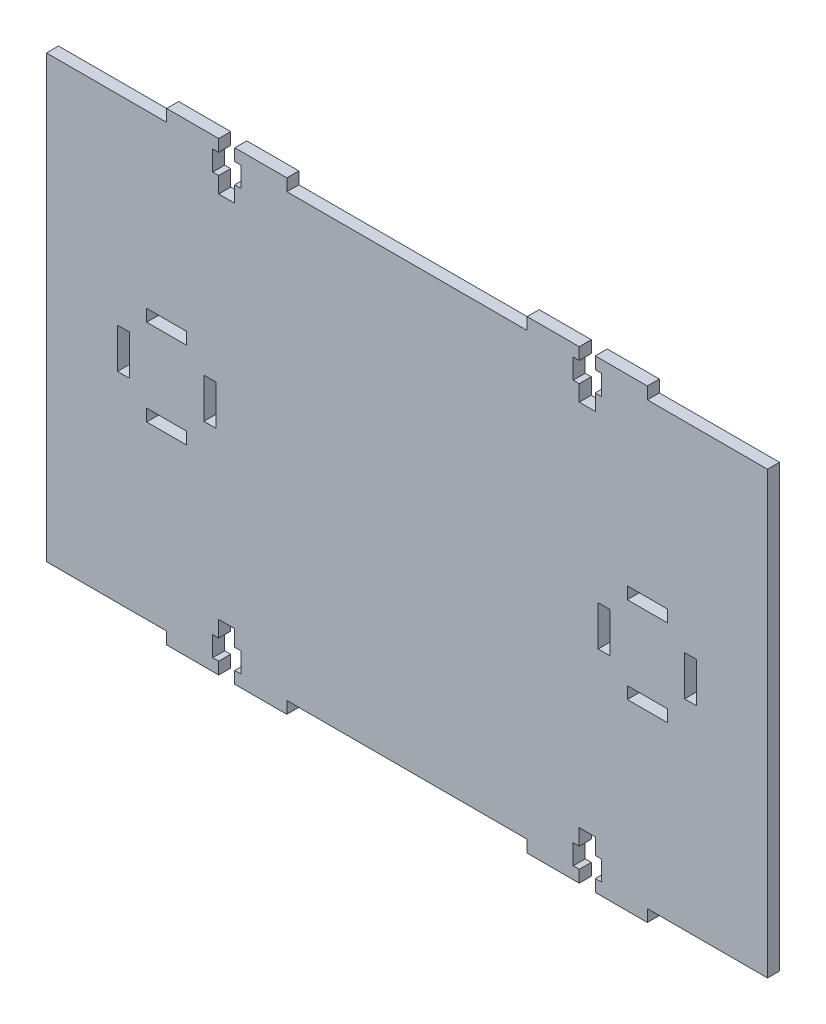
from build123d import *

# Parameters (mm, degrees)
SKETCH1_W                 = 3
SKETCH1_H                 = 3
PLATE_THICKNESS_3MM_DEPTH = 3
SKETCH_1_W                = 10
SKETCH_1_H                = 3
SKETCH_1_W_2              = 3
SKETCH_1_H_2              = 5
CUT_EXTRUDE_1_DEPTH       = 3


with BuildPart() as part:
    # Sketch1 → Plate_thickness_3mm (new body)
    with BuildSketch(Plane.XY):
        Polygon((30, -55), (-30, -55), (-30, -58), (-43, -58), (-43, -55), (-41.5, -55), (-41.5, -50), (-43, -50), (-43, -46), (-47, -46), (-47, -50), (-48.5, -50), (-48.5, -55), (-47, -55), (-47, -58), (-60, -58), (-60, -55), (-90, -55), (-90, 55), (-60, 55), (-60, 58), (-47, 58), (-47, 55), (-48.5, 55), (-48.5, 50), (-47, 50), (-47, 46), (-43, 46), (-43, 50), (-41.5, 50), (-41.5, 55), (-43, 55), (-43, 58), (-30, 58), (-30, 55), (30, 55), (30, 58), (43, 58), (43, 55), (41.5, 55), (41.5, 50), (43, 50), (43, 46), (47, 46), (47, 50), (48.5, 50), (48.5, 55), (47, 55), (47, 58), (60, 58), (60, 55), (90, 55), (90, -55), (60, -55), (60, -58), (47, -58), (47, -55), (48.5, -55), (48.5, -50), (47, -50), (47, -46), (43, -46), (43, -50), (41.5, -50), (41.5, -55), (43, -55), (43, -58), (30, -58), align=None)
        with Locations((-60, -10.785)):
            Rectangle(SKETCH1_W, SKETCH1_H, mode=Mode.SUBTRACT)
        with Locations((60, -10.785)):
            Rectangle(SKETCH1_W, SKETCH1_H, mode=Mode.SUBTRACT)
        with Locations((-70.785, 0)):
            Rectangle(SKETCH1_W, SKETCH1_H, mode=Mode.SUBTRACT)
        with Locations((-49.215, 0)):
            Rectangle(SKETCH1_W, SKETCH1_H, mode=Mode.SUBTRACT)
        with Locations((-60, 10.785)):
            Rectangle(SKETCH1_W, SKETCH1_H, mode=Mode.SUBTRACT)
        with Locations((49.215, 0)):
            Rectangle(SKETCH1_W, SKETCH1_H, mode=Mode.SUBTRACT)
        with Locations((70.785, 0)):
            Rectangle(SKETCH1_W, SKETCH1_H, mode=Mode.SUBTRACT)
        with Locations((60, 10.785)):
            Rectangle(SKETCH1_W, SKETCH1_H, mode=Mode.SUBTRACT)
    extrude(amount=PLATE_THICKNESS_3MM_DEPTH)

    # 草图1 → 切除-拉伸1 (cut)
    with BuildSketch(Plane.XY.offset(3)):
        with Locations((-60, -10.785)):
            Rectangle(SKETCH_1_W, SKETCH_1_H)
        with Locations((-70.785, -2.5)):
            Rectangle(SKETCH_1_W_2, SKETCH_1_H_2)
        with Locations((-70.785, 2.5)):
            Rectangle(SKETCH_1_W_2, SKETCH_1_H_2)
        with Locations((-49.215, 2.5)):
            Rectangle(SKETCH_1_W_2, SKETCH_1_H_2)
        with Locations((-49.215, -2.5)):
            Rectangle(SKETCH_1_W_2, SKETCH_1_H_2)
        with Locations((-60, 10.785)):
            Rectangle(SKETCH_1_W, SKETCH_1_H)
        with Locations((60, 10.785)):
            Rectangle(SKETCH_1_W, SKETCH_1_H)
        with Locations((49.215, 2.5)):
            Rectangle(SKETCH_1_W_2, SKETCH_1_H_2)
        with Locations((49.215, -2.5)):
            Rectangle(SKETCH_1_W_2, SKETCH_1_H_2)
        with Locations((60, -10.785)):
            Rectangle(SKETCH_1_W, SKETCH_1_H)
        with Locations((70.785, -2.5)):
            Rectangle(SKETCH_1_W_2, SKETCH_1_H_2)
        with Locations((70.785, 2.5)):
            Rectangle(SKETCH_1_W_2, SKETCH_1_H_2)
    extrude(amount=-CUT_EXTRUDE_1_DEPTH, mode=Mode.SUBTRACT)


solid = part.part
